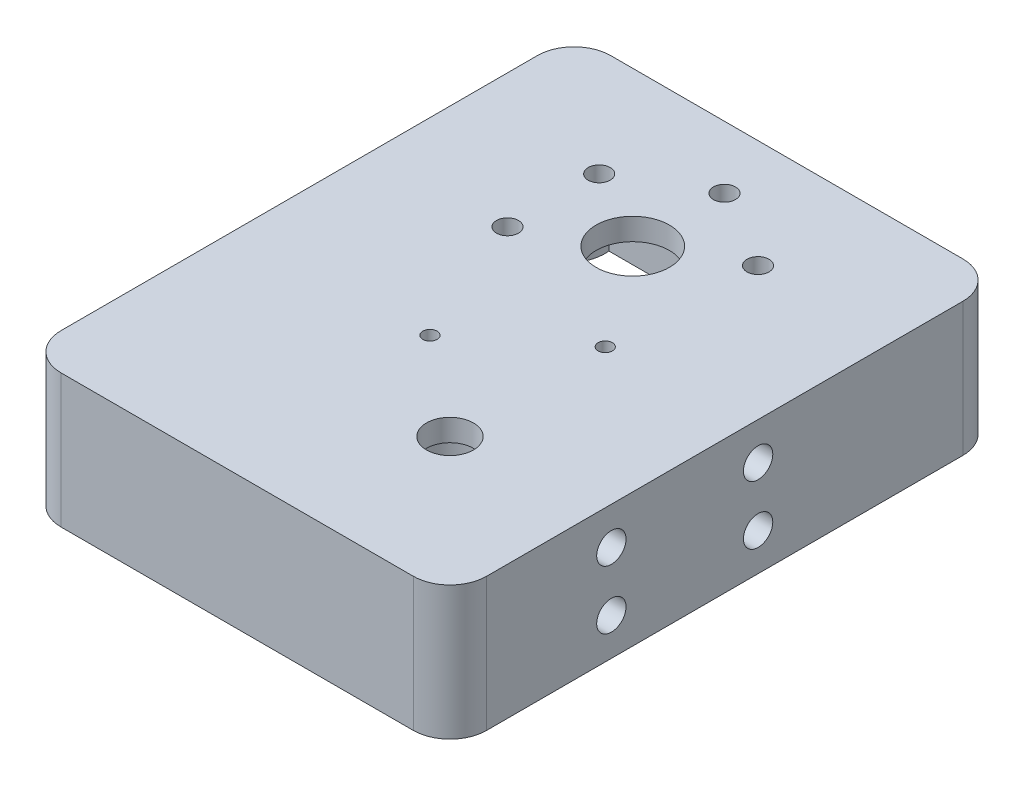
from build123d import *

# Parameters (mm, degrees)
SKETCH1_W           = 58
SKETCH1_H           = 74.913224731
SKETCH1_R           = 0.975
SKETCH1_R_2         = 3.2
SKETCH1_R_3         = 5
BOSS_EXTRUDE1_DEPTH = 3
SKETCH6_W           = 58
SKETCH6_H           = 74.913224731
SKETCH6_R           = 1.5
BOSS_EXTRUDE5_DEPTH = 15.2
SKETCH7_R           = 8
SKETCH7_R_2         = 5
BOSS_EXTRUDE6_DEPTH = 4
SKETCH2_R           = 1.5
CUT_EXTRUDE7_DEPTH  = 7
SKETCH5_R           = 2
CUT_EXTRUDE8_DEPTH  = 7
FILLET1_R           = 5
BOSS_EXTRUDE7_START = -5.01
SKETCH8_R           = 4
SKETCH8_R_2         = 0.975
BOSS_EXTRUDE7_DEPTH = 5.01


with BuildPart() as part:
    # Sketch1 → Boss-Extrude1 (new body)
    with BuildSketch(Plane(origin=(0, 0, 0), x_dir=(1, 0, 0), z_dir=(0, 1, 0))):
        with Locations((0, -16.456612366)):
            Rectangle(SKETCH1_W, SKETCH1_H)
        with Locations((-3.304338666, -24.330475908)):
            Circle(SKETCH1_R, mode=Mode.SUBTRACT)
        with Locations((10, -34.913224731)):
            Circle(SKETCH1_R_2, mode=Mode.SUBTRACT)
        with Locations((10, -13.747727085)):
            Circle(SKETCH1_R, mode=Mode.SUBTRACT)
        Circle(SKETCH1_R_3, mode=Mode.SUBTRACT)
    extrude(amount=BOSS_EXTRUDE1_DEPTH)

    # Sketch6 → Boss-Extrude5 (add)
    with BuildSketch(Plane(origin=(0, 0, 0), x_dir=(1, 0, 0), z_dir=(0, 1, 0))):
        with Locations((0, -16.456612366)):
            Rectangle(SKETCH6_W, SKETCH6_H)
        with Locations((24.71466455, 15.465029351)):
            Circle(SKETCH6_R, mode=Mode.SUBTRACT)
        with Locations((24.71466455, -48.378254082)):
            Circle(SKETCH6_R, mode=Mode.SUBTRACT)
        with Locations((-24.71466455, 15.465029351)):
            Circle(SKETCH6_R, mode=Mode.SUBTRACT)
        with Locations((-24.71466455, -48.378254082)):
            Circle(SKETCH6_R, mode=Mode.SUBTRACT)
        with BuildLine():
            Line((-19.24074398, -48.913224731), (19.24074398, -48.913224731))
            ThreePointArc((19.24074398, -48.913224731), (20.408888756, -44.956223279), (24, -42.924883145))
            Line((24, -42.924883145), (24, 10.011658414))
            ThreePointArc((24, 10.011658414), (20.408888756, 12.042998549), (19.24074398, 16))
            Line((19.24074398, 16), (-19.24074398, 16))
            ThreePointArc((-19.24074398, 16), (-20.408888756, 12.042998549), (-24, 10.011658414))
            Line((-24, 10.011658414), (-24, -42.924883145))
            ThreePointArc((-24, -42.924883145), (-20.408888756, -44.956223279), (-19.24074398, -48.913224731))
        make_face(mode=Mode.SUBTRACT)
    extrude(amount=-BOSS_EXTRUDE5_DEPTH)

    # Sketch7 → Boss-Extrude6 (add)
    with BuildSketch(Plane.XZ):
        with Locations((10, 34.913224731)):
            Circle(SKETCH7_R)
        with Locations((10, 34.913224731)):
            Circle(SKETCH7_R_2, mode=Mode.SUBTRACT)
    extrude(amount=BOSS_EXTRUDE6_DEPTH)

    # Sketch2 → Cut-Extrude7 (cut)
    with BuildSketch(Plane(origin=(0, 0, 0), x_dir=(1, 0, 0), z_dir=(0, 1, 0))):
        with Locations((-10.825317547, -6.25)):
            Circle(SKETCH2_R)
        with Locations((-10.825317547, 6.25)):
            Circle(SKETCH2_R)
        with Locations((0, 12.5)):
            Circle(SKETCH2_R)
        with Locations((10.825317547, 6.25)):
            Circle(SKETCH2_R)
    extrude(amount=CUT_EXTRUDE7_DEPTH, mode=Mode.SUBTRACT)

    # Sketch5 → Cut-Extrude8 (cut)
    with BuildSketch(Plane(origin=(29, 0, 0), x_dir=(0, 0, -1), z_dir=(1, 0, 0))):
        with Locations((-31.913224731, -2.1)):
            Circle(SKETCH5_R)
        with Locations((-31.913224731, -10.1)):
            Circle(SKETCH5_R)
        with Locations((-11.913224731, -10.1)):
            Circle(SKETCH5_R)
        with Locations((-11.913224731, -2.1)):
            Circle(SKETCH5_R)
    cut_extrude8 = extrude(amount=-CUT_EXTRUDE8_DEPTH, mode=Mode.SUBTRACT)

    # Mirror1: Cut-Extrude8 across plane
    add(cut_extrude8.mirror(Plane(origin=(0, 0, 0), x_dir=(0, 0, 1), z_dir=(1, 0, 0))), mode=Mode.SUBTRACT)

    # Fillet1
    fillet1_edges = [part.edges().sort_by_distance(p)[0] for p in [
        (29, -6.1, -21),
        (29, -6.1, 53.913224731),
        (-29, -6.1, 53.913224731),
        (-29, -6.1, -21),
    ]]
    fillet(fillet1_edges, radius=FILLET1_R)

    # Sketch8 → Boss-Extrude7 (add)
    with BuildSketch(Plane(origin=(0, 0, 0), x_dir=(1, 0, 0), z_dir=(0, 1, 0)).offset(BOSS_EXTRUDE7_START)):
        with Locations((-3.304338666, -24.330475908)):
            Circle(SKETCH8_R)
        with Locations((-3.304338666, -24.330475908)):
            Circle(SKETCH8_R_2, mode=Mode.SUBTRACT)
    extrude(amount=BOSS_EXTRUDE7_DEPTH)


solid = part.part
